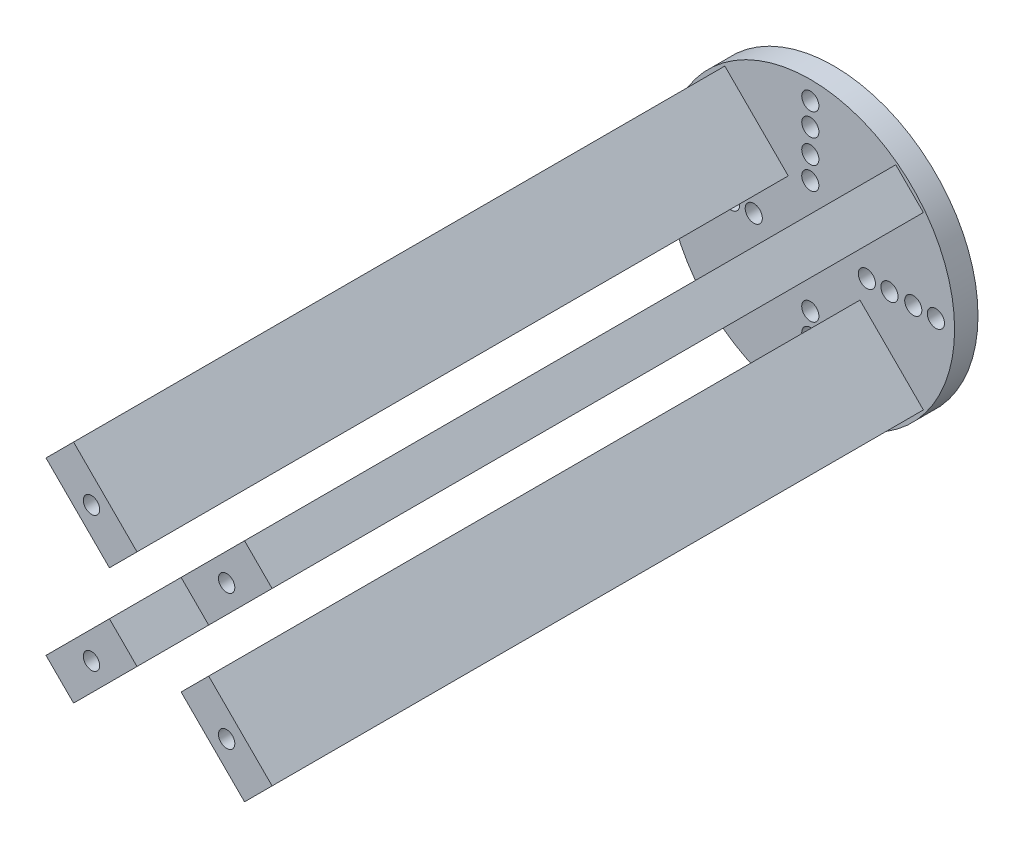
from build123d import *

# Parameters (mm, degrees)
AUFSATZ_LINEAR_AUSTRAGEN1_DEPTH = 3
AUFSATZ_LINEAR_AUSTRAGEN2_DEPTH = 83.5
SKIZZE5_R                       = 1.05
SCHNITT_LINEAR_AUSTRAGEN2_DEPTH = 13


with BuildPart() as part:
    # Skizze2 → Aufsatz-Linear austragen1 (new body)
    with BuildSketch(Plane.XY):
        with BuildLine():
            ThreePointArc((18.5, 0), (13.081475452, 13.081475452), (0, 18.5))
            Line((0, 18.5), (0, 17.2))
            ThreePointArc((0, 17.2), (0.777817459, 16.877817459), (1.1, 16.1))
            ThreePointArc((1.1, 16.1), (1.099839478, 16.081208438), (1.099357959, 16.06242236))
            ThreePointArc((1.099357959, 16.06242236), (0.764416312, 15.309008406), (0, 15))
            Line((0, 15), (0, 14.3))
            ThreePointArc((0, 14.3), (0.777817459, 13.977817459), (1.1, 13.2))
            ThreePointArc((1.1, 13.2), (1.099761155, 13.177078356), (1.099044724, 13.154166667))
            ThreePointArc((1.099044724, 13.154166667), (0.761440521, 12.40614338), (0, 12.1))
            Line((0, 12.1), (0, 11.25))
            ThreePointArc((0, 11.25), (0.777817459, 10.927817459), (1.1, 10.15))
            ThreePointArc((1.1, 10.15), (1.099595894, 10.120186092), (1.098383874, 10.090394089))
            ThreePointArc((1.098383874, 10.090394089), (0.756450097, 9.35138667), (0, 9.05))
            Line((0, 9.05), (0, 8.35))
            ThreePointArc((0, 8.35), (0.777817459, 8.027817459), (1.1, 7.25))
            ThreePointArc((1.1, 7.25), (1.099207253, 7.208245771), (1.096830153, 7.166551724))
            ThreePointArc((1.096830153, 7.166551724), (0.747732204, 6.443218399), (0, 6.15))
            Line((0, 6.15), (0, 0))
            Line((0, 0), (6.15, 0))
            ThreePointArc((6.15, 0), (6.443218399, 0.747732204), (7.166551724, 1.096830153))
            ThreePointArc((7.166551724, 1.096830153), (7.997732204, 0.806781601), (8.35, 0))
            Line((8.35, 0), (9.05, 0))
            ThreePointArc((9.05, 0), (9.35138667, 0.756450097), (10.090394089, 1.098383874))
            ThreePointArc((10.090394089, 1.098383874), (10.906450097, 0.79861333), (11.25, 0))
            Line((11.25, 0), (12.1, 0))
            ThreePointArc((12.1, 0), (12.40614338, 0.761440521), (13.154166667, 1.099044724))
            ThreePointArc((13.154166667, 1.099044724), (13.961440521, 0.79385662), (14.3, 0))
            Line((14.3, 0), (15, 0))
            ThreePointArc((15, 0), (15.309008406, 0.764416312), (16.06242236, 1.099357959))
            ThreePointArc((16.06242236, 1.099357959), (16.864416312, 0.790991594), (17.2, 0))
            Line((17.2, 0), (18.5, 0))
        make_face()
        with BuildLine():
            ThreePointArc((0, -18.5), (13.081475452, -13.081475452), (18.5, 0))
            Line((18.5, 0), (17.2, 0))
            ThreePointArc((17.2, 0), (16.864416312, -0.790991594), (16.06242236, -1.099357959))
            ThreePointArc((16.06242236, -1.099357959), (15.309008406, -0.764416312), (15, 0))
            Line((15, 0), (14.3, 0))
            ThreePointArc((14.3, 0), (13.961440521, -0.79385662), (13.154166667, -1.099044724))
            ThreePointArc((13.154166667, -1.099044724), (12.40614338, -0.761440521), (12.1, 0))
            Line((12.1, 0), (11.25, 0))
            ThreePointArc((11.25, 0), (10.906450097, -0.79861333), (10.090394089, -1.098383874))
            ThreePointArc((10.090394089, -1.098383874), (9.35138667, -0.756450097), (9.05, 0))
            Line((9.05, 0), (8.35, 0))
            ThreePointArc((8.35, 0), (7.997732204, -0.806781601), (7.166551724, -1.096830153))
            ThreePointArc((7.166551724, -1.096830153), (6.443218399, -0.747732204), (6.15, 0))
            Line((6.15, 0), (0, 0))
            Line((0, 0), (0, -6.15))
            ThreePointArc((0, -6.15), (0.747732204, -6.443218399), (1.096830153, -7.166551724))
            ThreePointArc((1.096830153, -7.166551724), (1.099207253, -7.208245771), (1.1, -7.25))
            ThreePointArc((1.1, -7.25), (0.777817459, -8.027817459), (0, -8.35))
            Line((0, -8.35), (0, -9.05))
            ThreePointArc((0, -9.05), (0.756450097, -9.35138667), (1.098383874, -10.090394089))
            ThreePointArc((1.098383874, -10.090394089), (1.099595894, -10.120186092), (1.1, -10.15))
            ThreePointArc((1.1, -10.15), (0.777817459, -10.927817459), (0, -11.25))
            Line((0, -11.25), (0, -12.1))
            ThreePointArc((0, -12.1), (0.761440521, -12.40614338), (1.099044724, -13.154166667))
            ThreePointArc((1.099044724, -13.154166667), (1.099761155, -13.177078356), (1.1, -13.2))
            ThreePointArc((1.1, -13.2), (0.777817459, -13.977817459), (0, -14.3))
            Line((0, -14.3), (0, -15))
            ThreePointArc((0, -15), (0.764416312, -15.309008406), (1.099357959, -16.06242236))
            ThreePointArc((1.099357959, -16.06242236), (1.099839478, -16.081208438), (1.1, -16.1))
            ThreePointArc((1.1, -16.1), (0.777817459, -16.877817459), (0, -17.2))
            Line((0, -17.2), (0, -18.5))
        make_face()
        with BuildLine():
            Line((-17.2, 0), (-18.5, 0))
            ThreePointArc((-18.5, 0), (-13.081475452, -13.081475452), (0, -18.5))
            Line((0, -18.5), (0, -17.2))
            ThreePointArc((0, -17.2), (-0.790991594, -16.864416312), (-1.099357959, -16.06242236))
            ThreePointArc((-1.099357959, -16.06242236), (-0.764416312, -15.309008406), (0, -15))
            Line((0, -15), (0, -14.3))
            ThreePointArc((0, -14.3), (-0.79385662, -13.961440521), (-1.099044724, -13.154166667))
            ThreePointArc((-1.099044724, -13.154166667), (-0.761440521, -12.40614338), (0, -12.1))
            Line((0, -12.1), (0, -11.25))
            ThreePointArc((0, -11.25), (-0.79861333, -10.906450097), (-1.098383874, -10.090394089))
            ThreePointArc((-1.098383874, -10.090394089), (-0.756450097, -9.35138667), (0, -9.05))
            Line((0, -9.05), (0, -8.35))
            ThreePointArc((0, -8.35), (-0.806781601, -7.997732204), (-1.096830153, -7.166551724))
            ThreePointArc((-1.096830153, -7.166551724), (-0.747732204, -6.443218399), (0, -6.15))
            Line((0, -6.15), (0, 0))
            Line((0, 0), (-6.15, 0))
            ThreePointArc((-6.15, 0), (-6.443218399, -0.747732204), (-7.166551724, -1.096830153))
            ThreePointArc((-7.166551724, -1.096830153), (-7.997732204, -0.806781601), (-8.35, 0))
            Line((-8.35, 0), (-9.05, 0))
            ThreePointArc((-9.05, 0), (-9.35138667, -0.756450097), (-10.090394089, -1.098383874))
            ThreePointArc((-10.090394089, -1.098383874), (-10.906450097, -0.79861333), (-11.25, 0))
            Line((-11.25, 0), (-12.1, 0))
            ThreePointArc((-12.1, 0), (-12.40614338, -0.761440521), (-13.154166667, -1.099044724))
            ThreePointArc((-13.154166667, -1.099044724), (-13.961440521, -0.79385662), (-14.3, 0))
            Line((-14.3, 0), (-15, 0))
            ThreePointArc((-15, 0), (-15.309008406, -0.764416312), (-16.06242236, -1.099357959))
            ThreePointArc((-16.06242236, -1.099357959), (-16.864416312, -0.790991594), (-17.2, 0))
        make_face()
        with BuildLine():
            Line((0, 17.2), (0, 18.5))
            ThreePointArc((0, 18.5), (-13.081475452, 13.081475452), (-18.5, 0))
            Line((-18.5, 0), (-17.2, 0))
            ThreePointArc((-17.2, 0), (-16.864416312, 0.790991594), (-16.06242236, 1.099357959))
            ThreePointArc((-16.06242236, 1.099357959), (-15.309008406, 0.764416312), (-15, 0))
            Line((-15, 0), (-14.3, 0))
            ThreePointArc((-14.3, 0), (-13.961440521, 0.79385662), (-13.154166667, 1.099044724))
            ThreePointArc((-13.154166667, 1.099044724), (-12.40614338, 0.761440521), (-12.1, 0))
            Line((-12.1, 0), (-11.25, 0))
            ThreePointArc((-11.25, 0), (-10.906450097, 0.79861333), (-10.090394089, 1.098383874))
            ThreePointArc((-10.090394089, 1.098383874), (-9.35138667, 0.756450097), (-9.05, 0))
            Line((-9.05, 0), (-8.35, 0))
            ThreePointArc((-8.35, 0), (-7.997732204, 0.806781601), (-7.166551724, 1.096830153))
            ThreePointArc((-7.166551724, 1.096830153), (-6.443218399, 0.747732204), (-6.15, 0))
            Line((-6.15, 0), (0, 0))
            Line((0, 0), (0, 6.15))
            ThreePointArc((0, 6.15), (-0.747732204, 6.443218399), (-1.096830153, 7.166551724))
            ThreePointArc((-1.096830153, 7.166551724), (-0.806781601, 7.997732204), (0, 8.35))
            Line((0, 8.35), (0, 9.05))
            ThreePointArc((0, 9.05), (-0.756450097, 9.35138667), (-1.098383874, 10.090394089))
            ThreePointArc((-1.098383874, 10.090394089), (-0.79861333, 10.906450097), (0, 11.25))
            Line((0, 11.25), (0, 12.1))
            ThreePointArc((0, 12.1), (-0.761440521, 12.40614338), (-1.099044724, 13.154166667))
            ThreePointArc((-1.099044724, 13.154166667), (-0.79385662, 13.961440521), (0, 14.3))
            Line((0, 14.3), (0, 15))
            ThreePointArc((0, 15), (-0.764416312, 15.309008406), (-1.099357959, 16.06242236))
            ThreePointArc((-1.099357959, 16.06242236), (-0.790991594, 16.864416312), (0, 17.2))
        make_face()
    extrude(amount=AUFSATZ_LINEAR_AUSTRAGEN1_DEPTH)

    # Skizze4 → Aufsatz-Linear austragen2 (add)
    with BuildSketch(Plane.XY.offset(3)):
        Polygon((2.828427125, 6.363961031), (10.960155108, 14.495689014), (14.495689014, 10.960155108), (6.363961031, 2.828427125), align=None)
        Polygon((6.363961031, -2.828427125), (14.495689014, -10.960155108), (10.960155108, -14.495689014), (2.828427125, -6.363961031), align=None)
        Polygon((-2.828427125, -6.363961031), (-10.960155108, -14.495689014), (-14.495689014, -10.960155108), (-6.363961031, -2.828427125), align=None)
        Polygon((-6.363961031, 2.828427125), (-14.495689014, 10.960155108), (-10.960155108, 14.495689014), (-2.828427125, 6.363961031), align=None)
    extrude(amount=AUFSATZ_LINEAR_AUSTRAGEN2_DEPTH)

    # Skizze5 → Schnitt-Linear austragen2 (cut)
    with BuildSketch(Plane.XY.offset(86.5)):
        with Locations((-8.66205807, -8.66205807)):
            Circle(SKIZZE5_R)
        with Locations((-8.66205807, 8.66205807)):
            Circle(SKIZZE5_R)
        with Locations((8.66205807, 8.66205807)):
            Circle(SKIZZE5_R)
        with Locations((8.66205807, -8.66205807)):
            Circle(SKIZZE5_R)
    extrude(amount=-SCHNITT_LINEAR_AUSTRAGEN2_DEPTH, mode=Mode.SUBTRACT)


solid = part.part
